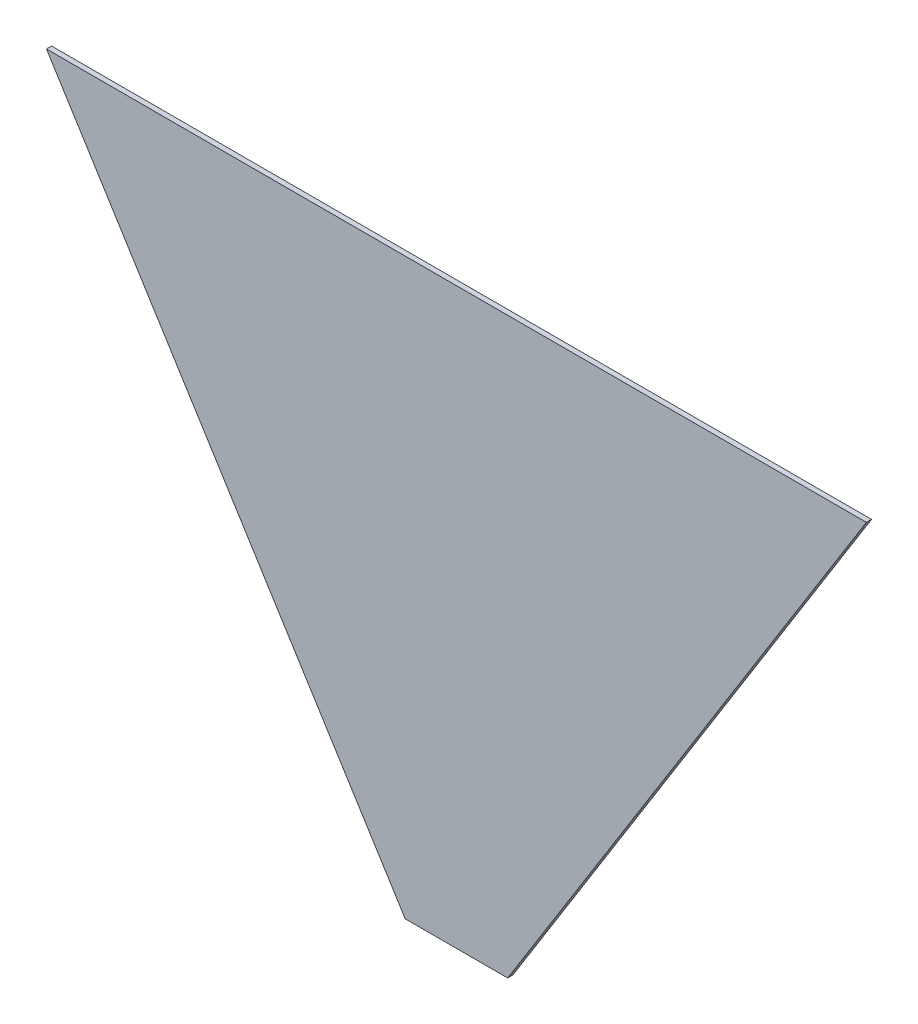
from build123d import *

# Parameters (mm, degrees)
SKETCH1_W           = 254
SKETCH1_H           = 177.8
BOSS_EXTRUDE1_DEPTH = 1.5875
CUT_EXTRUDE1_REACH  = 157.031


with BuildPart() as part:
    # Sketch1 → Boss-Extrude1 (new body)
    with BuildSketch(Plane.XY):
        Rectangle(SKETCH1_W, SKETCH1_H)
    extrude(amount=BOSS_EXTRUDE1_DEPTH)

    # Sketch2 → Cut-Extrude1 (cut, up to next)
    with BuildSketch(Plane.XY.offset(1.5875), mode=Mode.PRIVATE) as cut_extrude1_sk1:
        Polygon((127, -88.9), (127, 88.9), (15.875, -88.9), align=None)
    cut_extrude1_tool1 = extrude(cut_extrude1_sk1.sketch, amount=-CUT_EXTRUDE1_REACH, mode=Mode.PRIVATE) & part.part
    # Sketch2 → Cut-Extrude1 (cut, up to next)
    with BuildSketch(Plane.XY.offset(1.5875), mode=Mode.PRIVATE) as cut_extrude1_sk2:
        Polygon((-15.875, -88.9), (-127, 88.9), (-127, -88.9), align=None)
    cut_extrude1_tool2 = extrude(cut_extrude1_sk2.sketch, amount=-CUT_EXTRUDE1_REACH, mode=Mode.PRIVATE) & part.part
    add(cut_extrude1_tool1.solids().sort_by_distance((89.958333, -29.633333, 1.5875))[0], mode=Mode.SUBTRACT)
    add(cut_extrude1_tool2.solids().sort_by_distance((-89.958333, -29.633333, 1.5875))[0], mode=Mode.SUBTRACT)


solid = part.part
